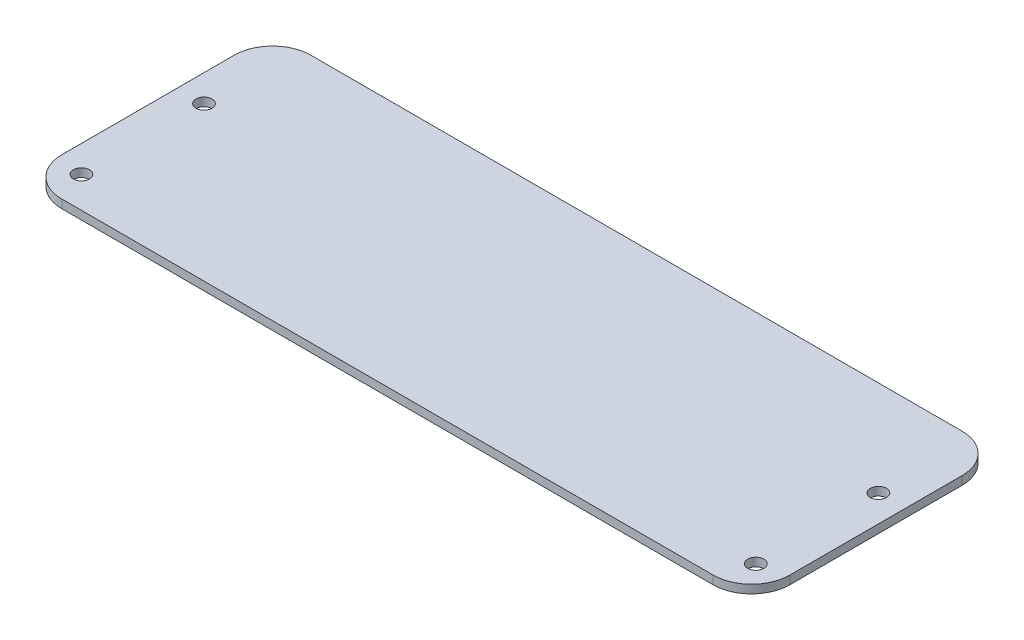
from build123d import *

# Parameters (mm, degrees)
SKETCH1_W           = 190
SKETCH1_H           = 65
SKETCH1_R           = 2.1
BOSS_EXTRUDE1_DEPTH = 2.2
FILLET1_R           = 10


with BuildPart() as part:
    # Sketch1 → Boss-Extrude1 (new body)
    with BuildSketch(Plane(origin=(0, 0, 0), x_dir=(1, 0, 0), z_dir=(0, 1, 0))):
        Rectangle(SKETCH1_W, SKETCH1_H)
        with Locations(Location((-88, 7.623179707, 0), (0, 0, 270))):
            Circle(SKETCH1_R, mode=Mode.SUBTRACT)
        with Locations(Location((-88, -24.376820293, 0), (0, 0, 270))):
            Circle(SKETCH1_R, mode=Mode.SUBTRACT)
        with Locations(Location((88, -24.376820293, 0), (0, 0, 90))):
            Circle(SKETCH1_R, mode=Mode.SUBTRACT)
        with Locations(Location((88, 7.623179707, 0), (0, 0, 90))):
            Circle(SKETCH1_R, mode=Mode.SUBTRACT)
    extrude(amount=BOSS_EXTRUDE1_DEPTH)

    # Fillet1
    fillet1_edges = [part.edges().sort_by_distance(p)[0] for p in [
        (95, 1.1, 32.5),
        (-95, 1.1, 32.5),
        (-95, 1.1, -32.5),
        (95, 1.1, -32.5),
    ]]
    fillet(fillet1_edges, radius=FILLET1_R)


solid = part.part
